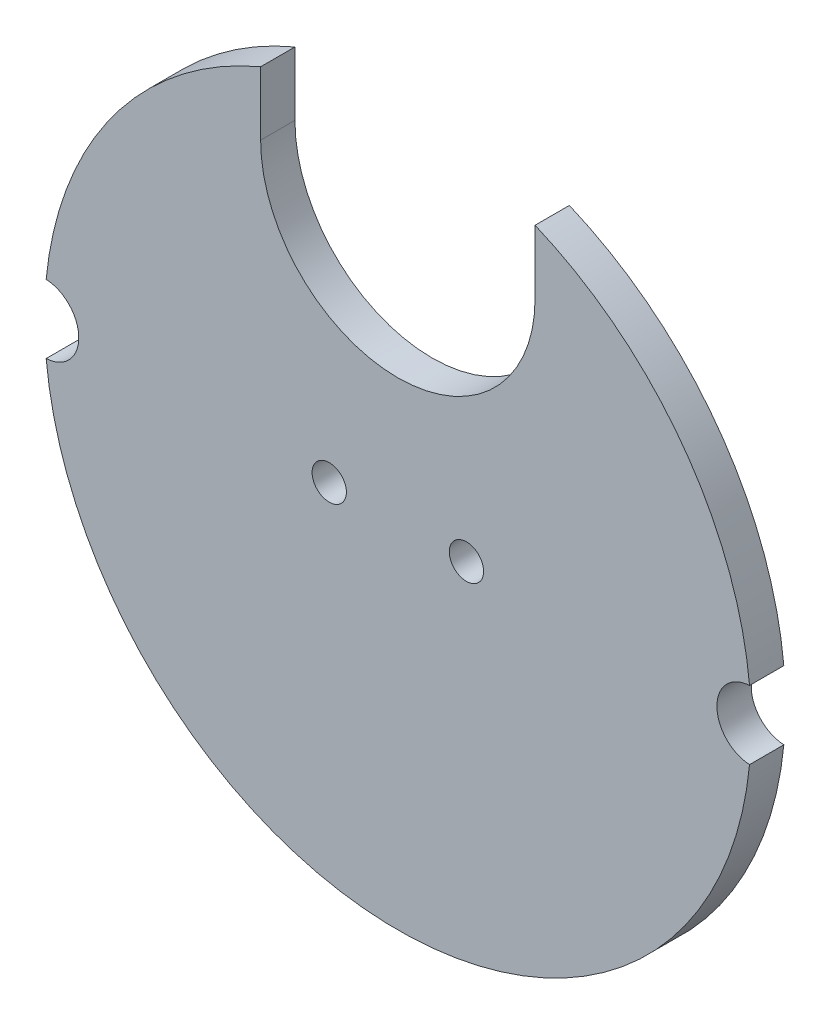
from build123d import *

# Parameters (mm, degrees)
SKETCH1_R      = 65.405
EXTRUDE1_DEPTH = 6.35
SKETCH2_R      = 6.35
SKETCH2_R_2    = 3.175
EXTRUDE2_DEPTH = 93.714349213


with BuildPart() as part:
    # Sketch1 → Extrude1 (new body)
    with BuildSketch(Plane.XY):
        Circle(SKETCH1_R)
    extrude(amount=EXTRUDE1_DEPTH)

    # Sketch2 → Extrude2 (cut, through all)
    with BuildSketch(Plane.XY.offset(6.35)):
        with Locations((-65.405, 0)):
            Circle(SKETCH2_R)
        with Locations((65.405, 0)):
            Circle(SKETCH2_R)
        with Locations((12.7, 0)):
            Circle(SKETCH2_R_2)
        with Locations((-12.7, 0)):
            Circle(SKETCH2_R_2)
        with BuildLine():
            Line((-25.4, 48.509773864), (-25.4, 60.271502595))
            Line((-25.4, 60.271502595), (-25.4, 72.027407772))
            Line((-25.4, 72.027407772), (25.4, 72.027407772))
            Line((25.4, 72.027407772), (25.4, 60.271502595))
            Line((25.4, 60.271502595), (25.4, 48.509773864))
            ThreePointArc((25.4, 48.509773864), (0, 23.109773864), (-25.4, 48.509773864))
        make_face()
    extrude(amount=-EXTRUDE2_DEPTH, mode=Mode.SUBTRACT)


solid = part.part
